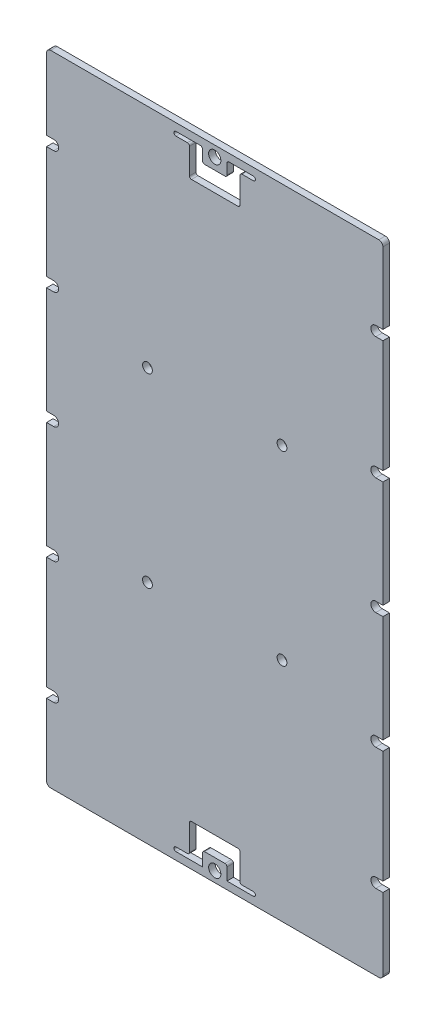
from build123d import *

# Parameters (mm, degrees)
SKETCH1_W                    = 82.5
SKETCH1_H                    = 156.7
SKETCH1_R                    = 0.8
SKETCH1_R_2                  = 1.5
BASE_SHAPE_DEPTH             = 1.6
PCB_CORNER_FILLETS_R         = 1
SKETCH6_R                    = 1.5
SOLAR_CONNECTOR_CUTOUT_DEPTH = 1.6
SOLAR_HOLE_FILLETS_R         = 0.5
M2_CLEARANCE_HOLE1_D         = 2.4
M2_CLEARANCE_HOLE1_DEPTH     = 1.6
SKETCH10_W                   = 1.75
SKETCH10_H                   = 2.4
SCREW_SLOTS_DEPTH            = 89.559838527


with BuildPart() as part:
    # Sketch1 → Base shape (new body)
    with BuildSketch(Plane.XY):
        Rectangle(SKETCH1_W, SKETCH1_H)
        with Locations((-39.5, 58.6)):
            Circle(SKETCH1_R, mode=Mode.SUBTRACT)
        with Locations((-39.5, 28.6)):
            Circle(SKETCH1_R, mode=Mode.SUBTRACT)
        with Locations((-39.5, 0)):
            Circle(SKETCH1_R, mode=Mode.SUBTRACT)
        with Locations((-39.5, -28.6)):
            Circle(SKETCH1_R, mode=Mode.SUBTRACT)
        with Locations((-39.5, -58.6)):
            Circle(SKETCH1_R, mode=Mode.SUBTRACT)
        with Locations((0, -75.8)):
            Circle(SKETCH1_R_2, mode=Mode.SUBTRACT)
        with Locations((39.5, -58.6)):
            Circle(SKETCH1_R, mode=Mode.SUBTRACT)
        with Locations((39.5, -28.6)):
            Circle(SKETCH1_R, mode=Mode.SUBTRACT)
        with Locations((39.5, 0)):
            Circle(SKETCH1_R, mode=Mode.SUBTRACT)
        with Locations((39.5, 28.6)):
            Circle(SKETCH1_R, mode=Mode.SUBTRACT)
        with Locations((39.5, 58.6)):
            Circle(SKETCH1_R, mode=Mode.SUBTRACT)
        with Locations((-16.5, 22.8)):
            Circle(SKETCH1_R, mode=Mode.SUBTRACT)
        with Locations((-16.5, -22.8)):
            Circle(SKETCH1_R, mode=Mode.SUBTRACT)
        with Locations((16.5, -22.8)):
            Circle(SKETCH1_R, mode=Mode.SUBTRACT)
        with Locations((16.5, 22.8)):
            Circle(SKETCH1_R, mode=Mode.SUBTRACT)
        with Locations((0, 75.8)):
            Circle(SKETCH1_R_2, mode=Mode.SUBTRACT)
    extrude(amount=BASE_SHAPE_DEPTH)

    # PCB corner fillets
    pcb_corner_fillets_edges = [part.edges().sort_by_distance(p)[0] for p in [
        (41.25, -78.35, 0.8),
        (-41.25, -78.35, 0.8),
        (-41.25, 78.35, 0.8),
        (41.25, 78.35, 0.8),
    ]]
    fillet(pcb_corner_fillets_edges, radius=PCB_CORNER_FILLETS_R)

    # Sketch6 → Solar connector cutout (cut)
    with BuildSketch(Plane(origin=(0, 0, 0), x_dir=(-1, 0, 0), z_dir=(0, 0, -1))):
        with Locations(Location((0, 75.8, 0), (0, 0, 180))):
            Circle(SKETCH6_R)
        with BuildLine():
            Line((9.5, 76.5), (3, 76.5))
            Line((3, 76.5), (3, 73))
            Line((3, 73), (-3, 73))
            Line((-3, 73), (-3, 76.5))
            Line((-3, 76.5), (-9.5, 76.5))
            ThreePointArc((-9.5, 76.5), (-10, 76), (-9.5, 75.5))
            Line((-9.5, 75.5), (-6.2, 75.5))
            Line((-6.2, 75.5), (-6.2, 68.2))
            Line((-6.2, 68.2), (6.2, 68.2))
            Line((6.2, 68.2), (6.2, 75.5))
            Line((6.2, 75.5), (9.5, 75.5))
            ThreePointArc((9.5, 75.5), (10, 76), (9.5, 76.5))
        make_face()
    solar_connector_cutout = extrude(amount=-SOLAR_CONNECTOR_CUTOUT_DEPTH, mode=Mode.SUBTRACT)

    # Mirror solar cutout: Solar connector cutout across plane
    add(solar_connector_cutout.mirror(Plane.ZX), mode=Mode.SUBTRACT)

    # Solar Hole fillets
    solar_hole_fillets_edges = [part.edges().sort_by_distance(p)[0] for p in [
        (-3, 76.5, 0.8),
        (-3, 73, 0.8),
        (3, 73, 0.8),
        (3, 76.5, 0.8),
        (6.2, 75.5, 0.8),
        (6.2, 68.2, 0.8),
        (-6.2, 68.2, 0.8),
        (-6.2, 75.5, 0.8),
        (-3, -73, 0.8),
        (3, -73, 0.8),
        (6.2, -75.5, 0.8),
        (6.2, -68.2, 0.8),
        (-6.2, -68.2, 0.8),
        (-6.2, -75.5, 0.8),
    ]]
    fillet(solar_hole_fillets_edges, radius=SOLAR_HOLE_FILLETS_R)

    # M2 Clearance Hole1
    with Locations(Plane(origin=(39.5, 58.6, 0), x_dir=(-1, 0, 0), z_dir=(0, 0, -1))):
        with Locations((0, 0), (0, -30), (23, -35.8), (56, -35.8), (79, -30), (79, 0), (79, -58.6), (0, -58.6), (23, -81.4), (56, -81.4), (79, -87.2), (0, -87.2), (0, -117.2), (79, -117.2)):
            Hole(M2_CLEARANCE_HOLE1_D / 2, depth=M2_CLEARANCE_HOLE1_DEPTH)

    # Sketch10 → Screw Slots (cut, through all)
    with BuildSketch(Plane(origin=(0, 0, 0), x_dir=(-1, 0, 0), z_dir=(0, 0, -1))):
        with Locations((40.375, 58.6)):
            Rectangle(SKETCH10_W, SKETCH10_H)
        with Locations((40.375, 28.6)):
            Rectangle(SKETCH10_W, SKETCH10_H)
        with Locations((40.375, 0)):
            Rectangle(SKETCH10_W, SKETCH10_H)
        with Locations((40.375, -28.6)):
            Rectangle(SKETCH10_W, SKETCH10_H)
        with Locations((40.375, -58.6)):
            Rectangle(SKETCH10_W, SKETCH10_H)
        with Locations((-40.375, -58.6)):
            Rectangle(SKETCH10_W, SKETCH10_H)
        with Locations((-40.375, -28.6)):
            Rectangle(SKETCH10_W, SKETCH10_H)
        with Locations((-40.375, 0)):
            Rectangle(SKETCH10_W, SKETCH10_H)
        with Locations((-40.375, 28.6)):
            Rectangle(SKETCH10_W, SKETCH10_H)
        with Locations((-40.375, 58.6)):
            Rectangle(SKETCH10_W, SKETCH10_H)
    extrude(amount=-SCREW_SLOTS_DEPTH, mode=Mode.SUBTRACT)


solid = part.part
